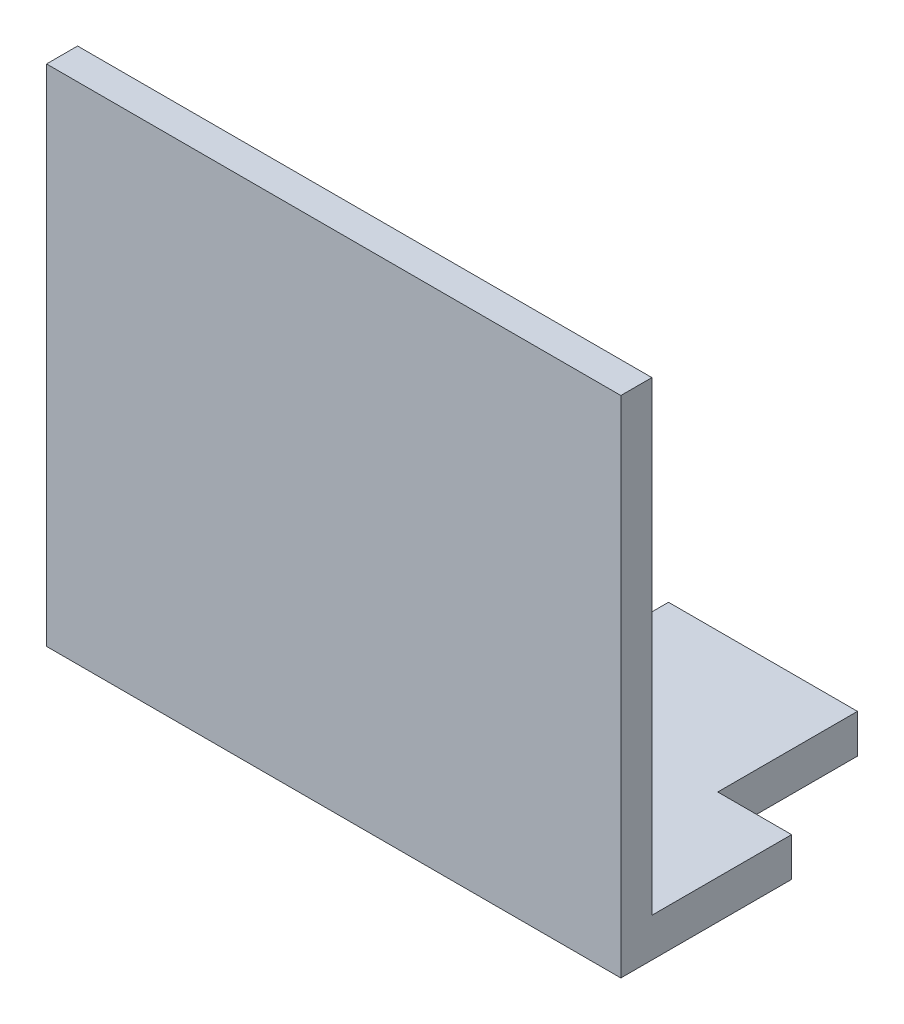
from build123d import *

# Parameters (mm, degrees)
EXTRUDE_1_DEPTH     = 74
SKETCH_2_W          = 9.512991355
SKETCH_2_H          = 18
CUT_EXTRUDE_1_DEPTH = 102.843016452


with BuildPart() as part:
    # Эскиз1 → Вытянуть1 (new body)
    with BuildSketch(Plane(origin=(0, 0, 0), x_dir=(0, 0, -1), z_dir=(1, 0, 0))):
        Polygon((0, 0), (0, 60), (-4, 60), (-4, -5), (36, -5), (36, 0), align=None)
    extrude(amount=-EXTRUDE_1_DEPTH)

    # Эскиз2 → Вырез-Вытянуть1 (cut, through all)
    with BuildSketch(Plane(origin=(0, 0, 0), x_dir=(1, 0, 0), z_dir=(0, 1, 0))):
        Polygon((-33.857381994, 16), (-69.85538749, 16), (-69.85538749, 0), (-75.857381994, 0), (-75.857381994, 39.592922538), (-33.857381994, 39.592922538), align=None)
        with Locations((-4.756495678, 27)):
            Rectangle(SKETCH_2_W, SKETCH_2_H)
    extrude(amount=-CUT_EXTRUDE_1_DEPTH, mode=Mode.SUBTRACT)


solid = part.part
